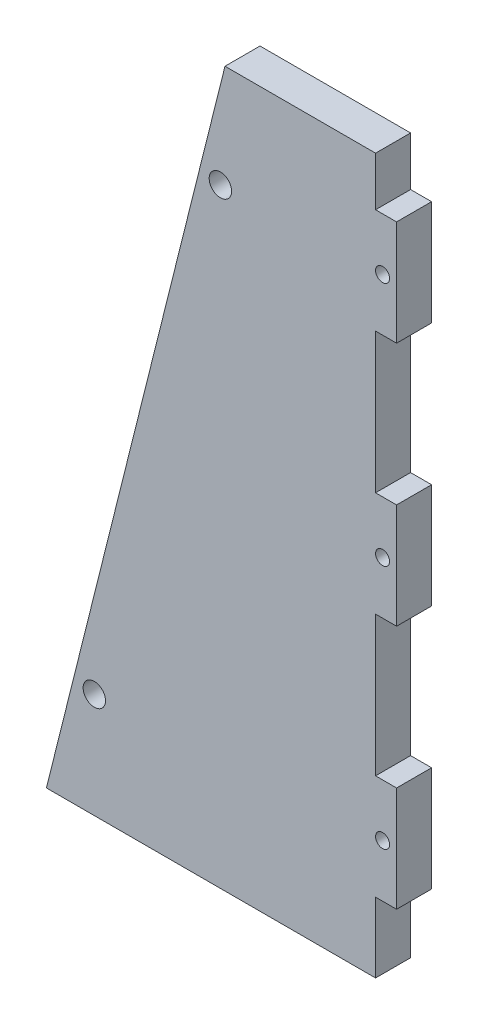
from build123d import *

# Parameters (mm, degrees)
EXTRUDE_1_DEPTH     = 5
SKETCH_2_W          = 3
SKETCH_2_H          = 10
SKETCH_2_H_2        = 20
SKETCH_2_H_3        = 12.022353437
CUT_EXTRUDE_1_DEPTH = 112.915146428
EXTRUDE_2_DEPTH     = 5
SKETCH_4_R          = 1.6
CUT_EXTRUDE_2_DEPTH = 114.705760628
SKETCH_5_R          = 1
CUT_EXTRUDE_3_DEPTH = 114.705760628


with BuildPart() as part:
    # 草图1 → 凸台-拉伸1 (new body)
    with BuildSketch(Plane.XY):
        Polygon((0, 0), (0, 100), (-25, 100), (-50, 0), align=None)
    extrude(amount=EXTRUDE_1_DEPTH)

    # 草图2 → 切除-拉伸1 (cut, through all)
    with BuildSketch(Plane.XY.offset(5)):
        with Locations((-1.5, 5)):
            Rectangle(SKETCH_2_W, SKETCH_2_H)
        with Locations((-1.5, 35)):
            Rectangle(SKETCH_2_W, SKETCH_2_H_2)
        with Locations((-1.5, 70)):
            Rectangle(SKETCH_2_W, SKETCH_2_H_2)
        with Locations((-1.5, 101.011176718)):
            Rectangle(SKETCH_2_W, SKETCH_2_H_3)
    extrude(amount=-CUT_EXTRUDE_1_DEPTH, mode=Mode.SUBTRACT)

    # 草图3 → 凸台-拉伸2 (add)
    with BuildSketch(Plane.XY.offset(5)):
        Polygon((-3, 100), (-3, 102), (-24.5, 102), (-25, 100), align=None)
    extrude(amount=-EXTRUDE_2_DEPTH)

    # 草图4 → 切除-拉伸2 (cut, through all)
    with BuildSketch(Plane.XY.offset(5)):
        with Locations((-25.157670781, 87)):
            Circle(SKETCH_4_R)
        with Locations((-43.157670781, 15)):
            Circle(SKETCH_4_R)
    extrude(amount=-CUT_EXTRUDE_2_DEPTH, mode=Mode.SUBTRACT)

    # 草图5 → 切除-拉伸3 (cut, through all)
    with BuildSketch(Plane.XY.offset(5)):
        with Locations((-2, 87.5)):
            Circle(SKETCH_5_R)
        with Locations((-2, 52.5)):
            Circle(SKETCH_5_R)
        with Locations((-2, 17.5)):
            Circle(SKETCH_5_R)
    extrude(amount=-CUT_EXTRUDE_3_DEPTH, mode=Mode.SUBTRACT)


solid = part.part
